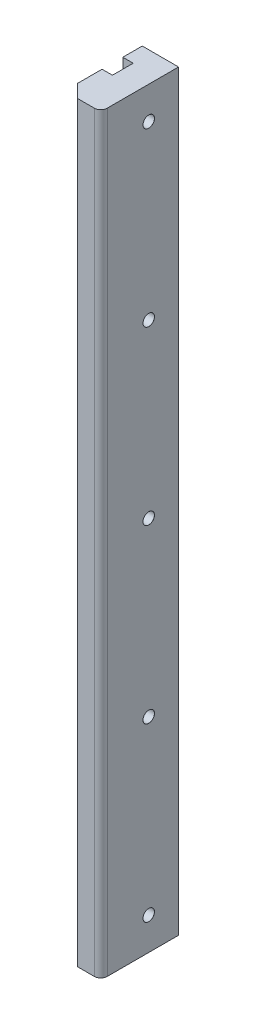
from build123d import *

# Parameters (mm, degrees)
BOSS_EXTRUDE1_DEPTH                     = 580
TAP_DRILL_FOR_M10X1_25_TAP1_D           = 8.8
TAP_DRILL_FOR_M10X1_25_TAP1_CSINK_D     = 8.85
TAP_DRILL_FOR_M10X1_25_TAP1_CSINK_ANGLE = 90


with BuildPart() as part:
    # Sketch1 → Boss-Extrude1 (new body)
    with BuildSketch(Plane(origin=(0, 0, 0), x_dir=(1, 0, 0), z_dir=(0, 1, 0))):
        with BuildLine():
            Line((-28, 27.5), (0, 27.5))
            Line((0, 27.5), (0, -27.5))
            ThreePointArc((0, -27.5), (-1.464466094, -31.035533906), (-5, -32.5))
            Line((-5, -32.5), (-18, -32.5))
            Line((-18, -32.5), (-28, -22.5))
            Line((-28, -22.5), (-28, -3.5))
            Line((-28, -3.5), (-20, -3.5))
            Line((-20, -3.5), (-20, 12.5))
            Line((-20, 12.5), (-28, 12.5))
            Line((-28, 12.5), (-28, 27.5))
        make_face()
    extrude(amount=BOSS_EXTRUDE1_DEPTH)

    # Tap Drill for M10x1.25 Tap1 (through all)
    with Locations(Plane(origin=(0, 25, -4.5), x_dir=(0, 0, 1), z_dir=(1, 0, 0))):
        with Locations((0, 0), (0, -132.5), (0, -265), (0, -397.5), (0, -530)):
            CounterSinkHole(TAP_DRILL_FOR_M10X1_25_TAP1_D / 2, TAP_DRILL_FOR_M10X1_25_TAP1_CSINK_D / 2, counter_sink_angle=TAP_DRILL_FOR_M10X1_25_TAP1_CSINK_ANGLE)


solid = part.part
